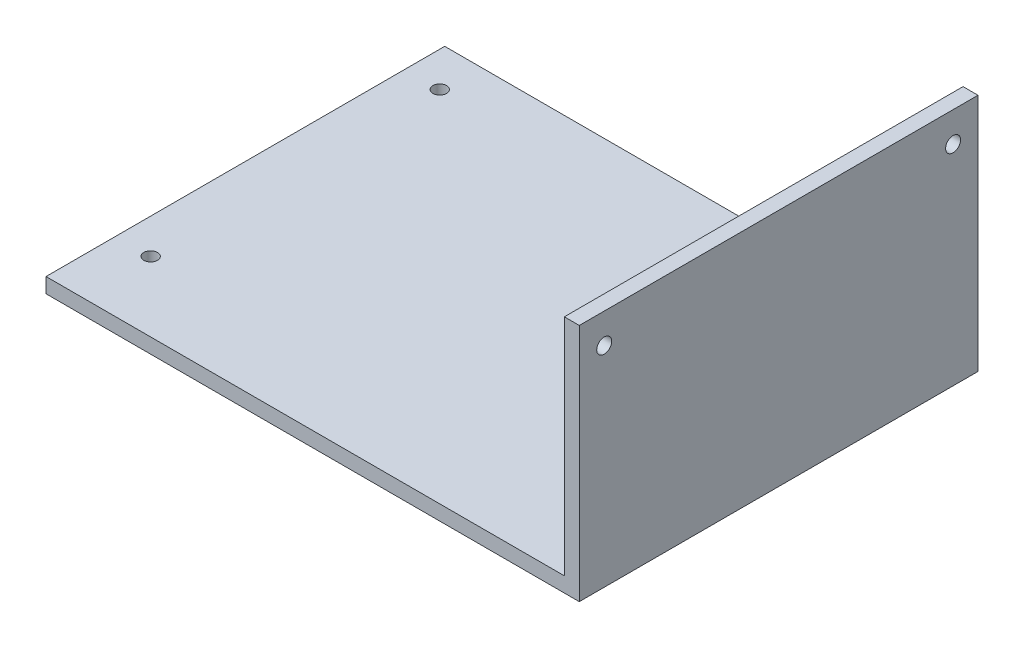
from build123d import *

# Parameters (mm, degrees)
SKETCH1_W               = 110
SKETCH1_H               = 80
SKETCH1_R               = 1.375
BOSS_EXTRUDE1_DEPTH     = 3
SKETCH3_W               = 3
SKETCH3_H               = 80
BOSS_EXTRUDE2_DEPTH     = 45
CUT_EXTRUDE1_DEPTH      = 141.292551477
CUT_EXTRUDE1_DEPTH_BACK = 141.292551477
SKETCH4_R               = 1.5
CUT_EXTRUDE2_DEPTH      = 138.764291455
CUT_EXTRUDE2_DEPTH_BACK = 138.764291455
SKETCH5_W               = 3
SKETCH5_H               = 80


with BuildPart() as part:
    # Sketch1 → Boss-Extrude1 (new body)
    with BuildSketch(Plane(origin=(0, 0, 0), x_dir=(1, 0, 0), z_dir=(0, 1, 0))):
        with Locations((50, 37)):
            Rectangle(SKETCH1_W, SKETCH1_H)
        with Locations(Location((5, 11, 0), (0, 0, 270))):
            Circle(SKETCH1_R, mode=Mode.SUBTRACT)
        with Locations(Location((5, 69, 0), (0, 0, 270))):
            Circle(SKETCH1_R, mode=Mode.SUBTRACT)
        with Locations(Location((91, 69, 0), (0, 0, 270))):
            Circle(SKETCH1_R, mode=Mode.SUBTRACT)
        with Locations(Location((91, 11, 0), (0, 0, 270))):
            Circle(SKETCH1_R, mode=Mode.SUBTRACT)
    extrude(amount=BOSS_EXTRUDE1_DEPTH)

    # Sketch3 → Boss-Extrude2 (add)
    with BuildSketch(Plane(origin=(0, 3, 0), x_dir=(1, 0, 0), z_dir=(0, 1, 0))):
        with Locations((-3.5, 37)):
            Rectangle(SKETCH3_W, SKETCH3_H)
        with Locations((103.5, 37)):
            Rectangle(SKETCH3_W, SKETCH3_H)
    extrude(amount=BOSS_EXTRUDE2_DEPTH)

    # Sketch4 → Cut-Extrude1 (cut, two sides: drawn at the far end of the back side and taken through both)
    with BuildSketch(Plane.ZY.offset(-102).offset(-CUT_EXTRUDE1_DEPTH_BACK)):
        with Locations((-72, 42)):
            Circle(SKETCH4_R)
        with Locations((-2, 42)):
            Circle(SKETCH4_R)
    extrude(amount=CUT_EXTRUDE1_DEPTH + CUT_EXTRUDE1_DEPTH_BACK, mode=Mode.SUBTRACT)

    # Sketch5 → Cut-Extrude2 (cut, two sides: drawn at the far end of the back side and taken through both)
    with BuildSketch(Plane(origin=(0, 3, 0), x_dir=(1, 0, 0), z_dir=(0, 1, 0)).offset(-CUT_EXTRUDE2_DEPTH_BACK)):
        with Locations((-3.5, 37)):
            Rectangle(SKETCH5_W, SKETCH5_H)
    extrude(amount=CUT_EXTRUDE2_DEPTH + CUT_EXTRUDE2_DEPTH_BACK, mode=Mode.SUBTRACT)


solid = part.part
